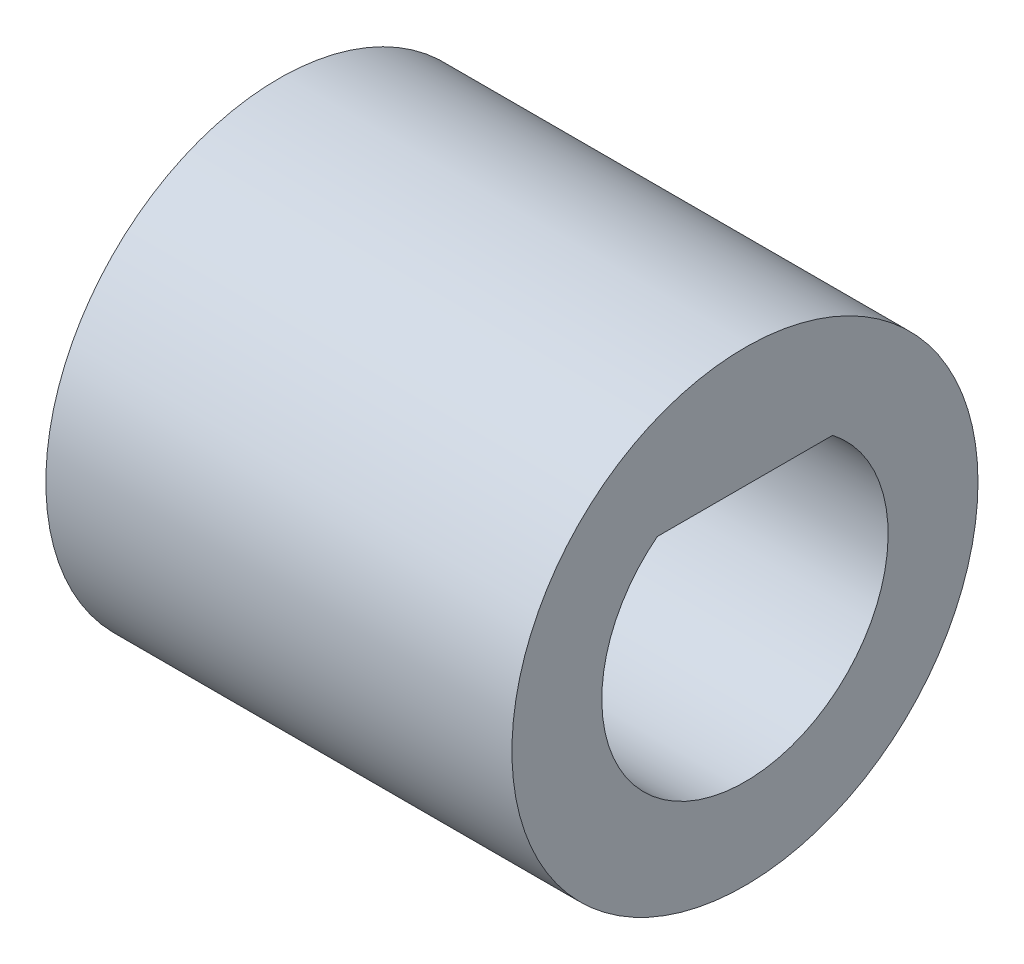
from build123d import *

# Parameters (mm, degrees)
SKETCH5_R           = 3.5
BOSS_EXTRUDE2_DEPTH = 7
CUT_EXTRUDE1_DEPTH  = 5


with BuildPart() as part:
    # Sketch5 → Boss-Extrude2 (new body)
    with BuildSketch(Plane(origin=(0, 0, 0), x_dir=(0, 0, -1), z_dir=(1, 0, 0))):
        Circle(SKETCH5_R)
    extrude(amount=BOSS_EXTRUDE2_DEPTH)

    # Sketch7 → Cut-Extrude1 (cut)
    with BuildSketch(Plane(origin=(7, 0, 0), x_dir=(0, 0, -1), z_dir=(1, 0, 0))):
        with BuildLine():
            Line((-1.316244658, 1.7), (1.316244658, 1.7))
            ThreePointArc((1.316244658, 1.7), (0, -2.15), (-1.316244658, 1.7))
        make_face()
    extrude(amount=-CUT_EXTRUDE1_DEPTH, mode=Mode.SUBTRACT)


solid = part.part
